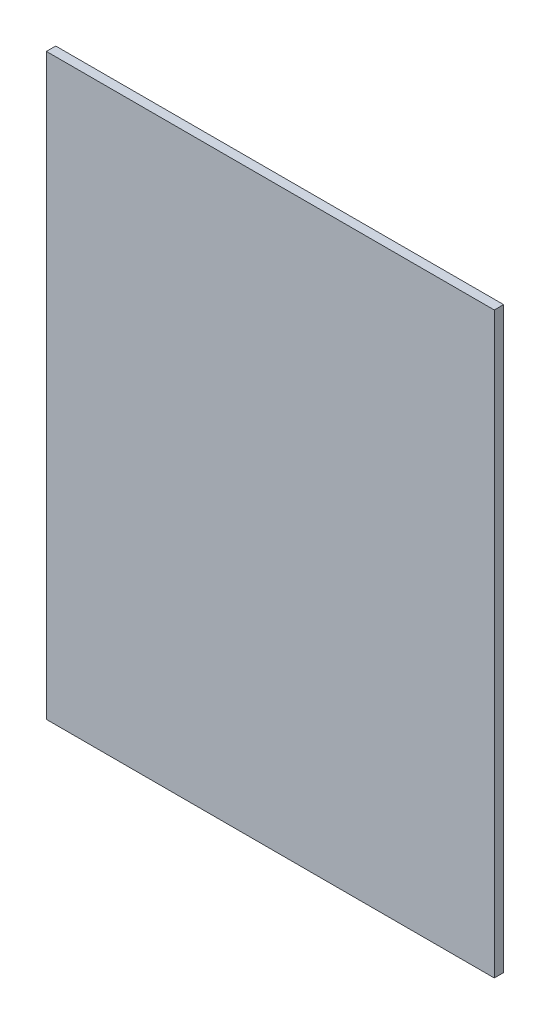
from build123d import *

# Parameters (mm, degrees)
ESQUISSE1_W        = 240
ESQUISSE1_H        = 310
BOSS_EXTRU_1_DEPTH = 5


with BuildPart() as part:
    # Esquisse1 → Boss.-Extru.1 (new body)
    with BuildSketch(Plane.XY):
        Rectangle(ESQUISSE1_W, ESQUISSE1_H)
    extrude(amount=BOSS_EXTRU_1_DEPTH)


solid = part.part
